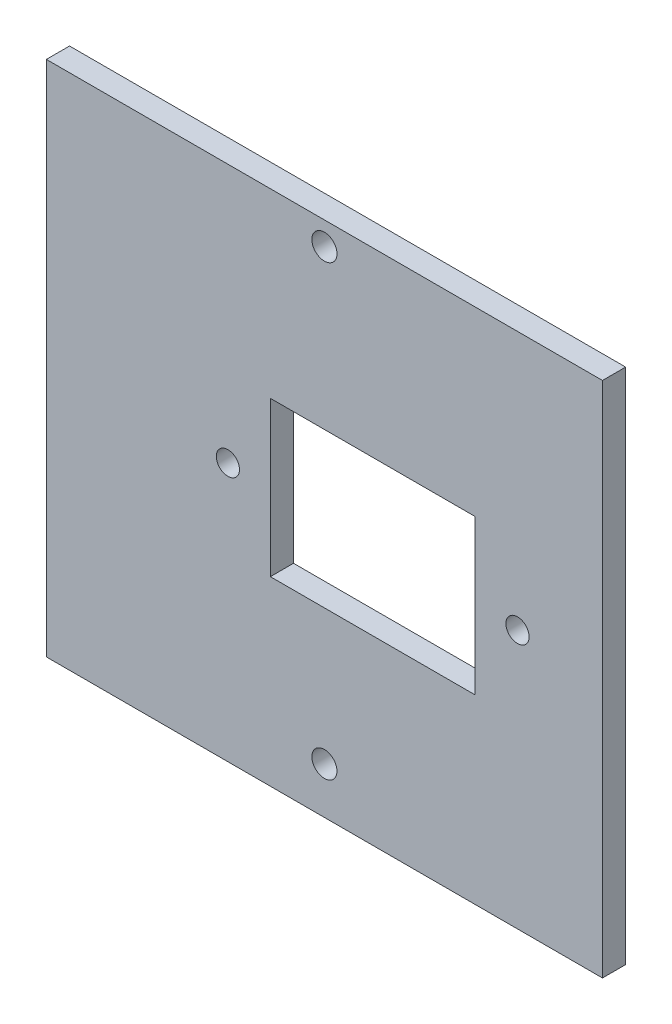
from build123d import *

# Parameters (mm, degrees)
CROQUIS1_W              = 72
CROQUIS1_H              = 67
SALIENTE_EXTRUIR1_DEPTH = 3
CROQUIS4_R              = 1.625
CROQUIS4_R_2            = 1.5
CROQUIS4_W              = 26.5
CROQUIS4_H              = 20
CORTAR_EXTRUIR2_DEPTH   = 3


with BuildPart() as part:
    # Croquis1 → Saliente-Extruir1 (new body)
    with BuildSketch(Plane.XY):
        with Locations((83.049688553, -19.639954107)):
            Rectangle(CROQUIS1_W, CROQUIS1_H)
    extrude(amount=SALIENTE_EXTRUIR1_DEPTH)

    # Croquis4 → Cortar-Extruir2 (cut)
    with BuildSketch(Plane(origin=(0, 0, 0), x_dir=(-1, 0, 0), z_dir=(0, 0, -1))):
        with Locations((-83.049688553, -47.139954107)):
            Circle(CROQUIS4_R)
        with Locations((-83.049688553, 10.860045893)):
            Circle(CROQUIS4_R)
        with Locations((-108.049688553, -19.639954107)):
            Circle(CROQUIS4_R_2)
        with Locations((-70.549688553, -19.639954107)):
            Circle(CROQUIS4_R_2)
        with Locations((-89.299688553, -19.639954107)):
            Rectangle(CROQUIS4_W, CROQUIS4_H)
    extrude(amount=-CORTAR_EXTRUIR2_DEPTH, mode=Mode.SUBTRACT)


solid = part.part
